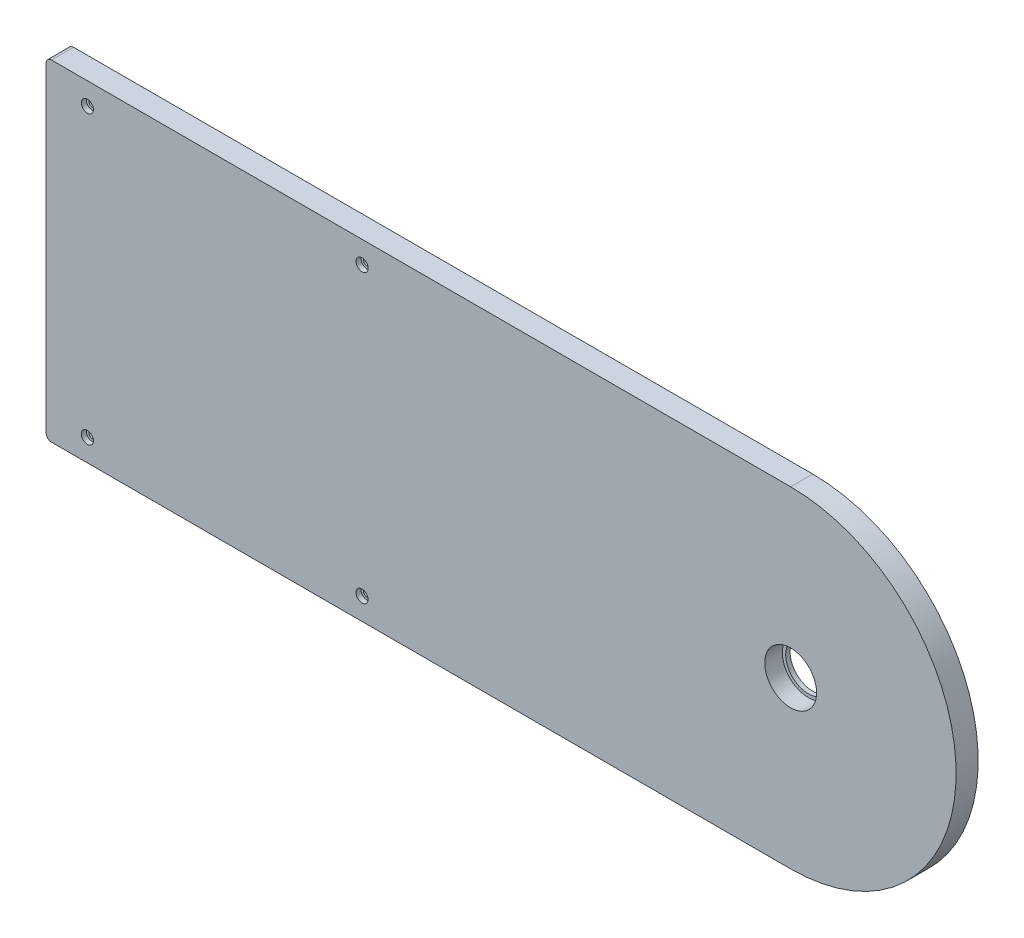
from build123d import *

# Parameters (mm, degrees)
SKETCH1_R           = 20.5
BOSS_EXTRUDE1_DEPTH = 20
SKETCH2_R           = 23.5
CUT_EXTRUDE1_DEPTH  = 16
SKETCH4_W           = 318.75
SKETCH4_H           = 8
BOSS_EXTRUDE2_DEPTH = 3
SKETCH3_R           = 3.25
CUT_EXTRUDE2_DEPTH  = 692.848249257
SKETCH5_R           = 5.5
CUT_EXTRUDE3_DEPTH  = 4.5
FILLET1_R           = 5


with BuildPart() as part:
    # Sketch1 → Boss-Extrude1 (new body)
    with BuildSketch(Plane.XY):
        with BuildLine():
            Line((0, 150), (-675, 150))
            Line((-675, 150), (-675, -150))
            Line((-675, -150), (0, -150))
            ThreePointArc((0, -150), (150, 0), (0, 150))
        make_face()
        Circle(SKETCH1_R, mode=Mode.SUBTRACT)
    extrude(amount=BOSS_EXTRUDE1_DEPTH)

    # Sketch2 → Cut-Extrude1 (cut)
    with BuildSketch(Plane.XY.offset(20)):
        Circle(SKETCH2_R)
    extrude(amount=-CUT_EXTRUDE1_DEPTH, mode=Mode.SUBTRACT)

    # Sketch4 → Boss-Extrude2 (add)
    with BuildSketch(Plane(origin=(0, 0, 0), x_dir=(-1, 0, 0), z_dir=(0, 0, -1))):
        with Locations((515.625, -130)):
            Rectangle(SKETCH4_W, SKETCH4_H)
        with Locations((515.625, 130)):
            Rectangle(SKETCH4_W, SKETCH4_H)
    extrude(amount=BOSS_EXTRUDE2_DEPTH)

    # Sketch3 → Cut-Extrude2 (cut, through all)
    with BuildSketch(Plane.XY.offset(20)):
        with Locations((-388.5, 130)):
            Circle(SKETCH3_R)
        with Locations((-637.5, 130)):
            Circle(SKETCH3_R)
        with Locations((-637.5, -130)):
            Circle(SKETCH3_R)
        with Locations((-388.5, -130)):
            Circle(SKETCH3_R)
    extrude(amount=-CUT_EXTRUDE2_DEPTH, mode=Mode.SUBTRACT)

    # Sketch5 → Cut-Extrude3 (cut)
    with BuildSketch(Plane.XY.offset(20)):
        with Locations((-637.5, 130)):
            Circle(SKETCH5_R)
        with Locations((-388.5, 130)):
            Circle(SKETCH5_R)
        with Locations((-388.5, -130)):
            Circle(SKETCH5_R)
        with Locations((-637.5, -130)):
            Circle(SKETCH5_R)
    extrude(amount=-CUT_EXTRUDE3_DEPTH, mode=Mode.SUBTRACT)

    # Fillet1
    fillet1_edges = [part.edges().sort_by_distance(p)[0] for p in [
        (-675, -150, 10),
        (-675, 150, 10),
    ]]
    fillet(fillet1_edges, radius=FILLET1_R)


solid = part.part
